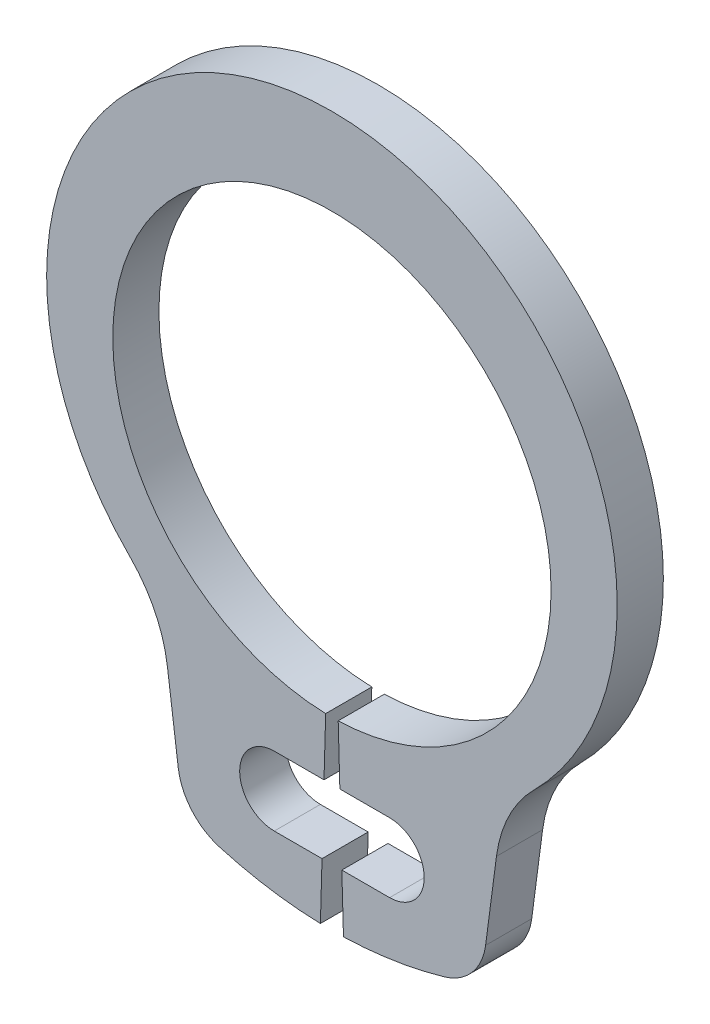
from build123d import *

# Parameters (mm, degrees)
BODYSKE_R   = 0.6
BODY_DEPTH  = 0.8
NOTSKE_W    = 2
NOTSKE_H    = 1.2
NOTCH_DEPTH = 9.606517152


with BuildPart() as part:
    # BodySke → Body (new body)
    with BuildSketch(Plane.XY):
        with BuildLine():
            Line((0.108571429, -3.798448663), (0.2, -6.997142274))
            ThreePointArc((0.2, -6.997142274), (1.084734325, -6.915442968), (1.951992703, -6.722330287))
            ThreePointArc((1.951992703, -6.722330287), (2.431793921, -6.413487277), (2.664581464, -5.892523581))
            Line((2.664581464, -5.892523581), (2.852981252, -4.461485117))
            ThreePointArc((2.852981252, -4.461485117), (3.069466671, -3.746780682), (3.503702758, -3.139238596))
            ThreePointArc((3.503702758, -3.139238596), (0, 5.3), (-3.503702758, -3.139238596))
            ThreePointArc((-3.503702758, -3.139238596), (-3.069466671, -3.746780682), (-2.852981252, -4.461485117))
            Line((-2.852981252, -4.461485117), (-2.664581464, -5.892523581))
            ThreePointArc((-2.664581464, -5.892523581), (-2.431793921, -6.413487277), (-1.951992703, -6.722330287))
            ThreePointArc((-1.951992703, -6.722330287), (-1.084734325, -6.915442968), (-0.2, -6.997142274))
            Line((-0.2, -6.997142274), (-0.108571429, -3.798448663))
            ThreePointArc((-0.108571429, -3.798448663), (0, 3.8), (0.108571429, -3.798448663))
        make_face()
        with Locations((1, -5.408326913)):
            Circle(BODYSKE_R, mode=Mode.SUBTRACT)
        with Locations((-1, -5.408326913)):
            Circle(BODYSKE_R, mode=Mode.SUBTRACT)
    extrude(amount=-BODY_DEPTH)

    # NotSke → Notch (cut, through all)
    with BuildSketch(Plane.XY):
        with Locations((0, -5.408326913)):
            Rectangle(NOTSKE_W, NOTSKE_H)
    extrude(amount=-NOTCH_DEPTH, mode=Mode.SUBTRACT)


solid = part.part
